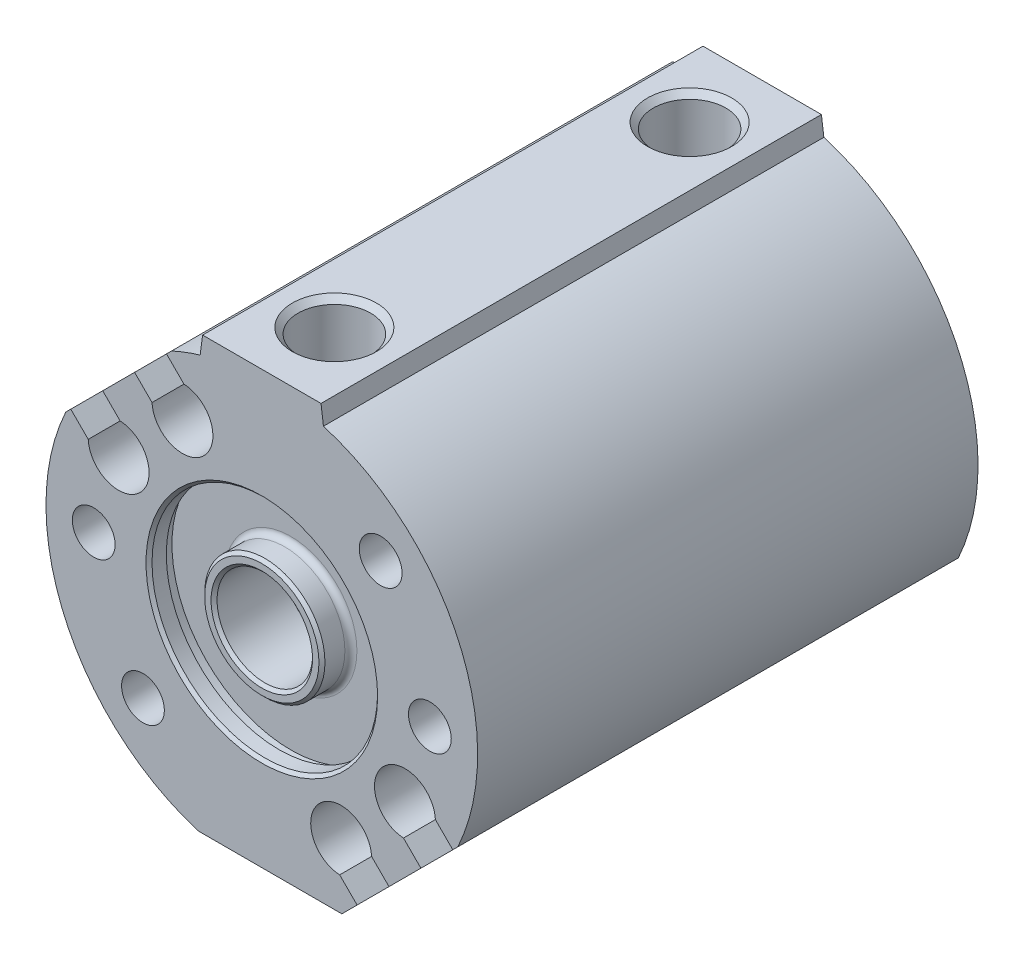
from build123d import *

# Parameters (mm, degrees)
EXTRUDE1_DEPTH                       = 16.637
EXTRUDE1_DEPTH_BACK                  = 16.637
SKETCH1_W                            = 28.702
SKETCH1_H                            = 28.702
SKETCH2_R                            = 20.295378834
F_056_BODY_DEPTH                     = 39.97513923
F_056_250_NOSE_CHAMFER_R             = 0.4
F_056_PORT_BOSS_DEPTH                = 33.274
SKETCH4_R                            = 1.13
F_056_MOUNT_THRU_HOLES_DEPTH         = 40.213396601
F_056_10_32_PORTS_AT_2_COUNT         = 2
F_056_10_32_PORTS_AT_2_PITCH         = 23.622
F_056_4_40_A_MOUNT_TAPPED_AT_2_COUNT = 2
F_056_4_40_A_MOUNT_TAPPED_AT_2_PITCH = 20.650555311
F_056_4_40_A_MOUNT_TAPPED_AT_3_COUNT = 2
F_056_4_40_A_MOUNT_TAPPED_AT_3_PITCH = 22.352
F_056_4_40_A_MOUNT_TAPPED_AT_4_COUNT = 2
F_056_4_40_A_MOUNT_TAPPED_AT_4_PITCH = 8.55374008
F_056_250_START                      = -12.025
SKETCH22_R                           = 7.112
F_056_250_STROKE_CHAMBER_DEPTH       = 24.05
SKETCH23_R                           = 3.175
F_056_250_ROD_THRU_BORE_DEPTH        = 27.59551026
SKETCH41_R                           = 7.112
SKETCH41_R_2                         = 6.612
END_PLATE_DEPTH                      = 1
END_PLATE_TAPER                      = 30
F_056_250_COLLAR_CHAMFER_SIZE        = 0.2


with BuildPart() as part:
    # Sketch1 → Extrude1 (new, two sides: drawn at the far end of the back side and taken through both)
    with BuildSketch(Plane.XY.offset(-EXTRUDE1_DEPTH_BACK)):
        Rectangle(SKETCH1_W, SKETCH1_H)
    extrude(amount=EXTRUDE1_DEPTH + EXTRUDE1_DEPTH_BACK)

    # Sketch2 → 056_Body (cut, through all)
    with BuildSketch(Plane.XY.offset(16.637)):
        Circle(SKETCH2_R)
        with BuildLine():
            Line((-4.221675615, -13.716), (5.322142977, -13.716))
            Line((5.322142977, -13.716), (6.337090973, -12.701052004))
            Line((6.337090973, -12.701052004), (5.17770228, -11.54166331))
            ThreePointArc((5.17770228, -11.54166331), (3.844539569, -8.087180256), (7.299022623, -9.420342967))
            Line((7.299022623, -9.420342967), (8.458411317, -10.57973166))
            Line((8.458411317, -10.57973166), (10.57973166, -8.458411317))
            Line((10.57973166, -8.458411317), (9.420342967, -7.299022623))
            ThreePointArc((9.420342967, -7.299022623), (8.087180256, -3.844539569), (11.54166331, -5.17770228))
            Line((11.54166331, -5.17770228), (12.701052004, -6.337090973))
            Line((12.701052004, -6.337090973), (13.035160011, -6.002982966))
            ThreePointArc((13.035160011, -6.002982966), (10.147689417, 10.147689417), (-6.002982966, 13.035160011))
            Line((-6.002982966, 13.035160011), (-6.337090973, 12.701052004))
            Line((-6.337090973, 12.701052004), (-5.17770228, 11.54166331))
            ThreePointArc((-5.17770228, 11.54166331), (-3.844539569, 8.087180256), (-7.299022623, 9.420342967))
            Line((-7.299022623, 9.420342967), (-8.458411317, 10.57973166))
            Line((-8.458411317, 10.57973166), (-10.57973166, 8.458411317))
            Line((-10.57973166, 8.458411317), (-9.420342967, 7.299022623))
            ThreePointArc((-9.420342967, 7.299022623), (-8.087180256, 3.844539569), (-11.54166331, 5.17770228))
            Line((-11.54166331, 5.17770228), (-12.701052004, 6.337090973))
            Line((-12.701052004, 6.337090973), (-13.035160011, 6.002982966))
            ThreePointArc((-13.035160011, 6.002982966), (-13.10187644, -5.855940125), (-4.221675615, -13.716))
        make_face(mode=Mode.SUBTRACT)
    extrude(amount=-F_056_BODY_DEPTH, mode=Mode.SUBTRACT)

    # Sketch33 → 056-250 Front Recess (revolve, cut)
    with BuildSketch(Plane(origin=(0, 0, 0), x_dir=(0, 0, -1), z_dir=(1, 0, 0)), mode=Mode.PRIVATE) as f_056_250_front_recess_sk:
        Polygon((-16.637, 7.5), (-15.487, 7.5), (-15.487, 7.9), (-14.712, 7.9), (-14.712, 4), (-16.637, 4), align=None)
    revolve(f_056_250_front_recess_sk.sketch.rotate(Axis((0, 0, 61.220394237), (0, 0, -1)), 90), axis=Axis((0, 0, 61.220394237), (0, 0, -1)), mode=Mode.SUBTRACT)

    # 056-250 Nose Chamfer
    f_056_250_nose_chamfer_edges = [part.edges().sort_by_distance(p)[0] for p in [
        (-4, 0, 14.712),
    ]]
    fillet(f_056_250_nose_chamfer_edges, radius=F_056_250_NOSE_CHAMFER_R)

    # Sketch3 → 056_Port Boss (add)
    with BuildSketch(Plane.XY.offset(16.637)):
        with BuildLine():
            Line((-3.937, 14.986), (3.937, 14.986))
            Line((3.937, 14.986), (4.099319032, 13.753064549))
            ThreePointArc((4.099319032, 13.753064549), (0, 14.351), (-4.099319032, 13.753064549))
            Line((-4.099319032, 13.753064549), (-3.937, 14.986))
        make_face()
    extrude(amount=-F_056_PORT_BOSS_DEPTH)

    # Sketch4 → 056_Mount Thru Holes (cut, through all)
    with BuildSketch(Plane.XY.offset(16.637)):
        with Locations((7.902625387, 7.902625387)):
            Circle(SKETCH4_R)
        with Locations((11.176, 0)):
            Circle(SKETCH4_R)
        with Locations((-7.902625387, -7.902625387)):
            Circle(SKETCH4_R)
        with Locations((-11.176, 0)):
            Circle(SKETCH4_R)
    extrude(amount=-F_056_MOUNT_THRU_HOLES_DEPTH, mode=Mode.SUBTRACT)

    # Sketch12 → 056 #10-32 Ports (revolve, cut)
    with BuildSketch(Plane(origin=(0, 14.986, -11.811), x_dir=(0, 0, 1), z_dir=(1, 0, 0))):
        Polygon((0, 0), (0, 7.213317848), (2.0193, 6), (2.0193, 4), (2.413, 4), (2.413, 0.3869944), (2.7999944, 0), align=None)
    f_056_10_32_ports = revolve(axis=Axis((0, 21.336, -11.811), (0, -1, 0)), mode=Mode.SUBTRACT)

    # 056 #10-32 Ports at 2: 056 #10-32 Ports ×2
    with Locations(*[(0, 0, i * F_056_10_32_PORTS_AT_2_PITCH) for i in range(1, F_056_10_32_PORTS_AT_2_COUNT)]):
        add(f_056_10_32_ports, mode=Mode.SUBTRACT)

    # Sketch32 → 056 #4-40 A Mount Tapped (revolve, cut)
    with BuildSketch(Plane(origin=(7.902625387, 7.902625387, 16.637), x_dir=(0, -1, 0), z_dir=(1, 0, 0))):
        Polygon((0, 0), (0, 11.224152758), (1.1303, 10.545), (1.1303, 8.64), (1.4224, 8.64), (1.4224, 0), align=None)
    f_056_4_40_a_mount_tapped = revolve(axis=Axis((7.902625387, 7.902625387, 22.987), (0, 0, -1)), mode=Mode.SUBTRACT)

    # 056 #4-40 A Mount Tapped at 2: 056 #4-40 A Mount Tapped ×2
    with Locations(*[Vector(-0.9238795325112864, -0.38268343236509095, 0) * (i * F_056_4_40_A_MOUNT_TAPPED_AT_2_PITCH) for i in range(1, F_056_4_40_A_MOUNT_TAPPED_AT_2_COUNT)]):
        add(f_056_4_40_a_mount_tapped, mode=Mode.SUBTRACT)

    # 056 #4-40 A Mount Tapped at 3: 056 #4-40 A Mount Tapped ×2
    with Locations(*[Vector(-0.7071067811865461, -0.707106781186549, 0) * (i * F_056_4_40_A_MOUNT_TAPPED_AT_3_PITCH) for i in range(1, F_056_4_40_A_MOUNT_TAPPED_AT_3_COUNT)]):
        add(f_056_4_40_a_mount_tapped, mode=Mode.SUBTRACT)

    # 056 #4-40 A Mount Tapped at 4: 056 #4-40 A Mount Tapped ×2
    with Locations(*[Vector(0.38268343236509034, -0.9238795325112865, 0) * (i * F_056_4_40_A_MOUNT_TAPPED_AT_4_PITCH) for i in range(1, F_056_4_40_A_MOUNT_TAPPED_AT_4_COUNT)]):
        add(f_056_4_40_a_mount_tapped, mode=Mode.SUBTRACT)

    # 056 4-40 A Mount Tapped to Rear: 056 #4-40 A Mount Tapped across plane
    add(f_056_4_40_a_mount_tapped.mirror(Plane.XY), mode=Mode.SUBTRACT)

    # 056 4-40 A Mount Tapped to Rear copy 1 s → 056 4-40 A Mount Tapped to Rear copy 1 (revolve, cut)
    with BuildSketch(Plane(origin=(-11.176, 0, -16.637), x_dir=(0, -1, 0), z_dir=(1, 0, 0))):
        Polygon((0, 0), (0, -11.224152758), (1.1303, -10.545), (1.1303, -8.64), (1.4224, -8.64), (1.4224, 0), align=None)
    revolve(axis=Axis((-11.176, 0, -22.987), (0, 0, -1)), mode=Mode.SUBTRACT)

    # 056 4-40 A Mount Tapped to Rear copy 2 s → 056 4-40 A Mount Tapped to Rear copy 2 (revolve, cut)
    with BuildSketch(Plane(origin=(-7.902625387, -7.902625387, -16.637), x_dir=(0, -1, 0), z_dir=(1, 0, 0))):
        Polygon((0, 0), (0, -11.224152758), (1.1303, -10.545), (1.1303, -8.64), (1.4224, -8.64), (1.4224, 0), align=None)
    revolve(axis=Axis((-7.902625387, -7.902625387, -22.987), (0, 0, -1)), mode=Mode.SUBTRACT)

    # 056 4-40 A Mount Tapped to Rear copy 3 s → 056 4-40 A Mount Tapped to Rear copy 3 (revolve, cut)
    with BuildSketch(Plane(origin=(11.176, 0, -16.637), x_dir=(0, -1, 0), z_dir=(1, 0, 0))):
        Polygon((0, 0), (0, -11.224152758), (1.1303, -10.545), (1.1303, -8.64), (1.4224, -8.64), (1.4224, 0), align=None)
    revolve(axis=Axis((11.176, 0, -22.987), (0, 0, -1)), mode=Mode.SUBTRACT)

    # Sketch22 → 056-250 Stroke Chamber (cut)
    with BuildSketch(Plane.XY.offset(F_056_250_START)):
        Circle(SKETCH22_R)
    extrude(amount=F_056_250_STROKE_CHAMBER_DEPTH, mode=Mode.SUBTRACT)

    # Sketch23 → 056-250 Rod Thru Bore (cut, through all)
    with BuildSketch(Plane.XY):
        Circle(SKETCH23_R)
    extrude(amount=F_056_250_ROD_THRU_BORE_DEPTH, mode=Mode.SUBTRACT)

    # Sketch41 → End Plate (cut)
    with BuildSketch(Plane(origin=(0, 0, -16.637), x_dir=(-1, 0, 0), z_dir=(0, 0, -1))):
        with Locations(Location((0, 0, 0), (0, 0, 180))):
            Circle(SKETCH41_R)
        Circle(SKETCH41_R_2, mode=Mode.SUBTRACT)
    extrude(amount=-END_PLATE_DEPTH, taper=END_PLATE_TAPER, mode=Mode.SUBTRACT)

    # 056-250 Collar Chamfer
    f_056_250_collar_chamfer_edges = [part.edges().sort_by_distance(p)[0] for p in [
        (-7.5, 0, 16.637),
        (-4, 0, 16.637),
        (-3.175, 0, 16.637),
    ]]
    chamfer(f_056_250_collar_chamfer_edges, length=F_056_250_COLLAR_CHAMFER_SIZE)


solid = part.part
